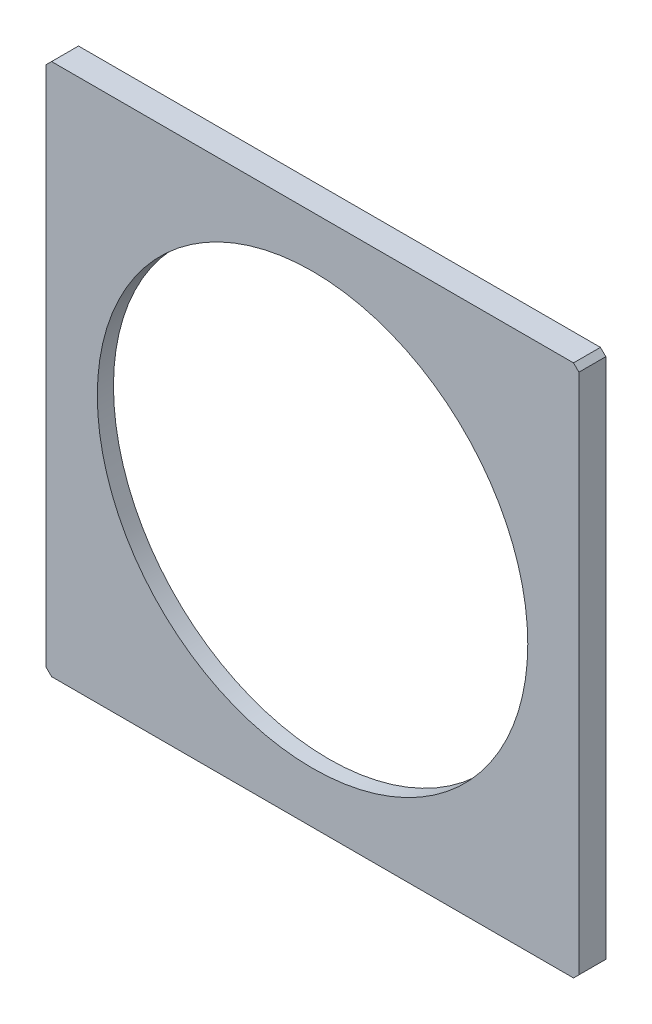
from build123d import *

# Parameters (mm, degrees)
SKETCH1_W               = 99
SKETCH1_H               = 99
SKETCH1_R               = 40
BOSS_EXTRUDE1_DEPTH     = 5
CUT_EXTRUDE1_DEPTH      = 71.1819065
CUT_EXTRUDE1_DEPTH_BACK = 2
SKETCH2_R               = 43
CHAMFER1_SIZE           = 1


with BuildPart() as part:
    # Sketch1 → Boss-Extrude1 (new body)
    with BuildSketch(Plane(origin=(0, 0, 0), x_dir=(0, 1, 0), z_dir=(0, 0, 1))):
        Rectangle(SKETCH1_W, SKETCH1_H)
        with Locations(Location((0, 0, 0), (0, 0, 270))):
            Circle(SKETCH1_R, mode=Mode.SUBTRACT)
    extrude(amount=BOSS_EXTRUDE1_DEPTH)

    # Sketch2 → Cut-Extrude1 (cut, two sides: drawn at the far end of the back side and taken through both)
    with BuildSketch(Plane(origin=(0, 0, 0), x_dir=(1, 0, 0), z_dir=(0, 0, -1)).offset(-CUT_EXTRUDE1_DEPTH_BACK)):
        with Locations(Location((0, 0, 0), (0, 0, 180))):
            Circle(SKETCH2_R)
    extrude(amount=CUT_EXTRUDE1_DEPTH + CUT_EXTRUDE1_DEPTH_BACK, mode=Mode.SUBTRACT)

    # Chamfer1
    chamfer1_edges = [part.edges().sort_by_distance(p)[0] for p in [
        (-49.5, -49.5, 2.5),
        (-49.5, 49.5, 2.5),
        (49.5, 49.5, 2.5),
        (49.5, -49.5, 2.5),
    ]]
    chamfer(chamfer1_edges, length=CHAMFER1_SIZE)


solid = part.part
